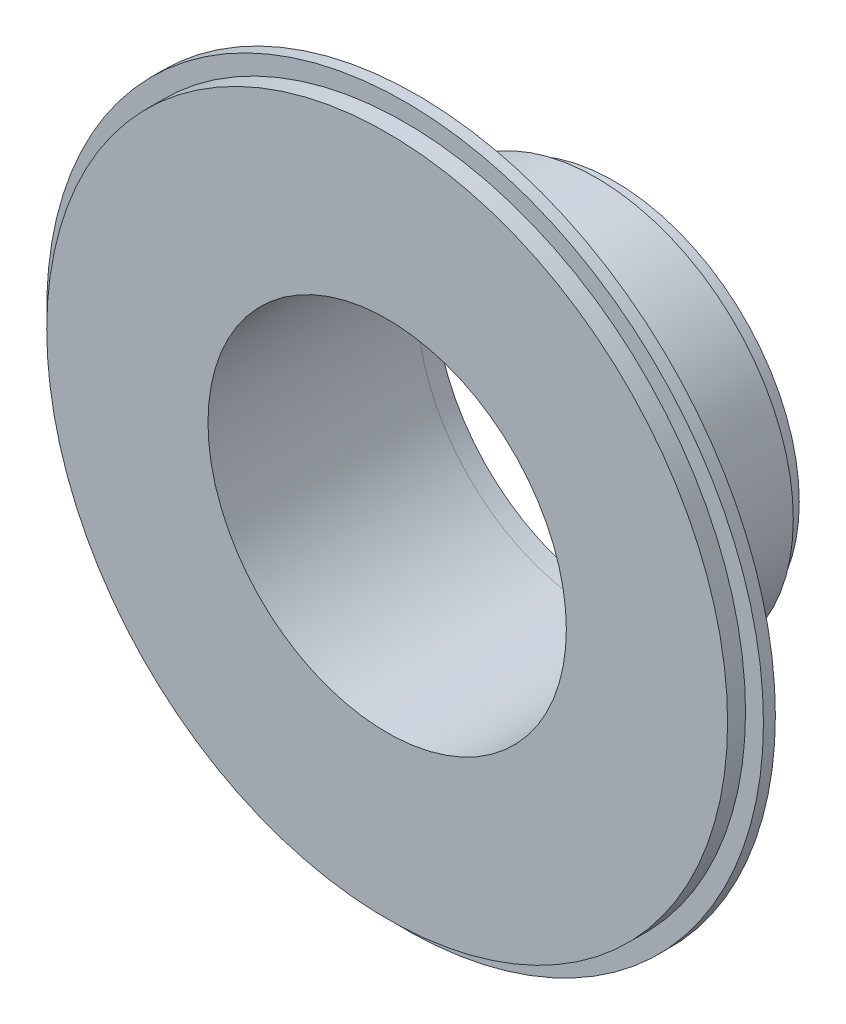
from build123d import *

# Parameters (mm, degrees)
SKETCH_1_R          = 31
SKETCH_1_R_2        = 30
EXTRUDE_1_DEPTH     = 3
SKETCH_2_R          = 33
SKETCH_2_R_2        = 30
EXTRUDE_3_DEPTH     = 30
EXTRUDE_START       = 5
SKETCH_4_R          = 60
SKETCH_4_R_2        = 33
SKETCH_4_R_3        = 30
EXTRUDE_4_DEPTH     = 5
SKETCH_5_R          = 60
SKETCH_5_R_2        = 57
CUT_EXTRUDE_1_DEPTH = 3


with BuildPart() as part:
    # 스케치1 → 보스-돌출1 (new body)
    with BuildSketch(Plane.XY):
        Circle(SKETCH_1_R)
        Circle(SKETCH_1_R_2, mode=Mode.SUBTRACT)
    extrude(amount=-EXTRUDE_1_DEPTH)


with BuildPart() as body_2:
    # 스케치2 → 보스-돌출3 (new body)
    with BuildSketch(Plane.XY):
        Circle(SKETCH_2_R)
        Circle(SKETCH_2_R_2, mode=Mode.SUBTRACT)
    extrude(amount=EXTRUDE_3_DEPTH)

    # 스케치4 → 보스-돌출4 (add)
    # profile 1 of 2: a face of its own
    with BuildSketch(Plane.XY.offset(30).offset(EXTRUDE_START)):
        Circle(SKETCH_4_R)
        Circle(SKETCH_4_R_2, mode=Mode.SUBTRACT)
    # profile 2 of 2: a face of its own
    with BuildSketch(Plane.XY.offset(30).offset(EXTRUDE_START)):
        Circle(SKETCH_4_R_2)
        Circle(SKETCH_4_R_3, mode=Mode.SUBTRACT)
    extrude(amount=-EXTRUDE_4_DEPTH)

    # 스케치5 → 컷-돌출1 (cut)
    with BuildSketch(Plane.XY.offset(35)):
        Circle(SKETCH_5_R)
        Circle(SKETCH_5_R_2, mode=Mode.SUBTRACT)
    extrude(amount=-CUT_EXTRUDE_1_DEPTH, mode=Mode.SUBTRACT)


solid = Compound([part.part, body_2.part])
